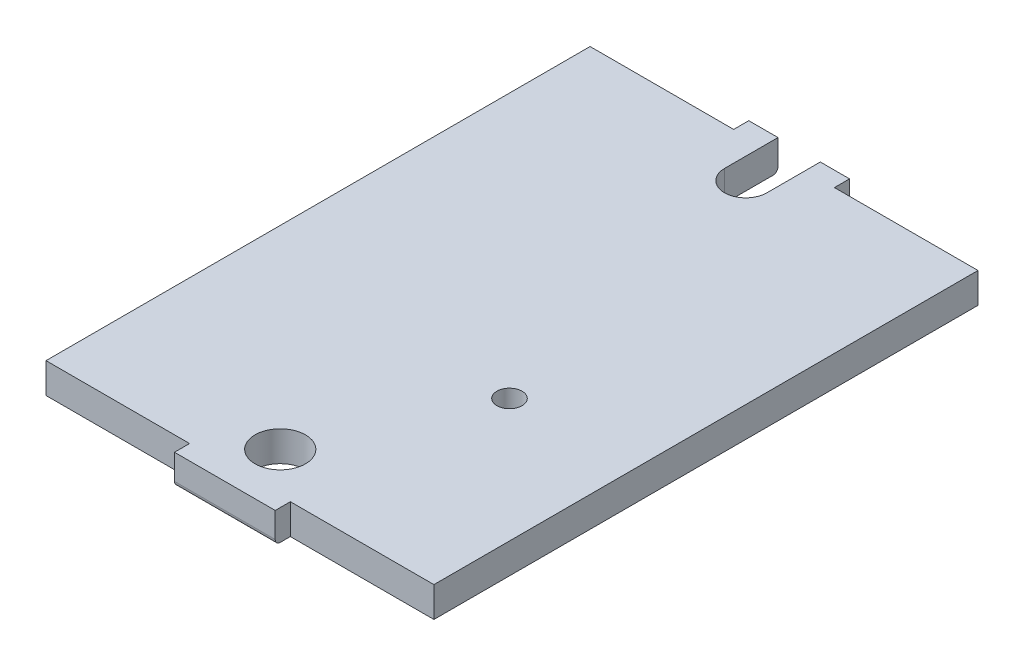
from build123d import *

# Parameters (mm, degrees)
BOSS_EXTRUDE1_DEPTH = 3
FILLET1_R           = 0.5
SKETCH2_R           = 2.5
CUT_EXTRUDE1_DEPTH  = 35.522637501
CUT_EXTRUDE2_DEPTH  = 35.522637501
SKETCH4_R           = 1.25
CUT_EXTRUDE3_DEPTH  = 35.522637501
CHAMFER1_SIZE       = 0.5


with BuildPart() as part:
    # Sketch1 → Boss-Extrude1 (new body)
    with BuildSketch(Plane(origin=(0, 0, 0), x_dir=(1, 0, 0), z_dir=(0, 1, 0))):
        Polygon((-19.25, 27), (-19.25, -27), (-5, -27), (-5, -28.5), (5, -28.5), (5, -27), (19.25, -27), (19.25, 27), (5, 27), (5, 28.5), (-5, 28.5), (-5, 27), align=None)
    extrude(amount=BOSS_EXTRUDE1_DEPTH)

    # Fillet1
    fillet1_edges = [part.edges().sort_by_distance(p)[0] for p in [
        (0, 0, 28.5),
        (0, 0, -28.5),
    ]]
    fillet(fillet1_edges, radius=FILLET1_R)

    # Sketch2 → Cut-Extrude1 (cut, through all)
    with BuildSketch(Plane(origin=(0, 3, 0), x_dir=(1, 0, 0), z_dir=(0, 1, 0))):
        with Locations(Location((0, -23, 0), (0, 0, 270))):
            Circle(SKETCH2_R)
    extrude(amount=-CUT_EXTRUDE1_DEPTH, mode=Mode.SUBTRACT)

    # Sketch3 → Cut-Extrude2 (cut, through all)
    with BuildSketch(Plane(origin=(0, 3, 0), x_dir=(1, 0, 0), z_dir=(0, 1, 0))):
        with BuildLine():
            Line((-2.1, 28.5), (2.1, 28.5))
            Line((2.1, 28.5), (2.1, 23.2))
            ThreePointArc((2.1, 23.2), (0, 21.1), (-2.1, 23.2))
            Line((-2.1, 23.2), (-2.1, 28.5))
        make_face()
    extrude(amount=-CUT_EXTRUDE2_DEPTH, mode=Mode.SUBTRACT)

    # Sketch4 → Cut-Extrude3 (cut, through all)
    with BuildSketch(Plane(origin=(0, 3, 0), x_dir=(1, 0, 0), z_dir=(0, 1, 0))):
        with Locations(Location((7, -7.25, 0), (0, 0, 270))):
            Circle(SKETCH4_R)
    extrude(amount=-CUT_EXTRUDE3_DEPTH, mode=Mode.SUBTRACT)

    # Chamfer1
    chamfer1_edges = [part.edges().sort_by_distance(p)[0] for p in [
        (7, 0, 6),
    ]]
    chamfer(chamfer1_edges, length=CHAMFER1_SIZE)


solid = part.part
